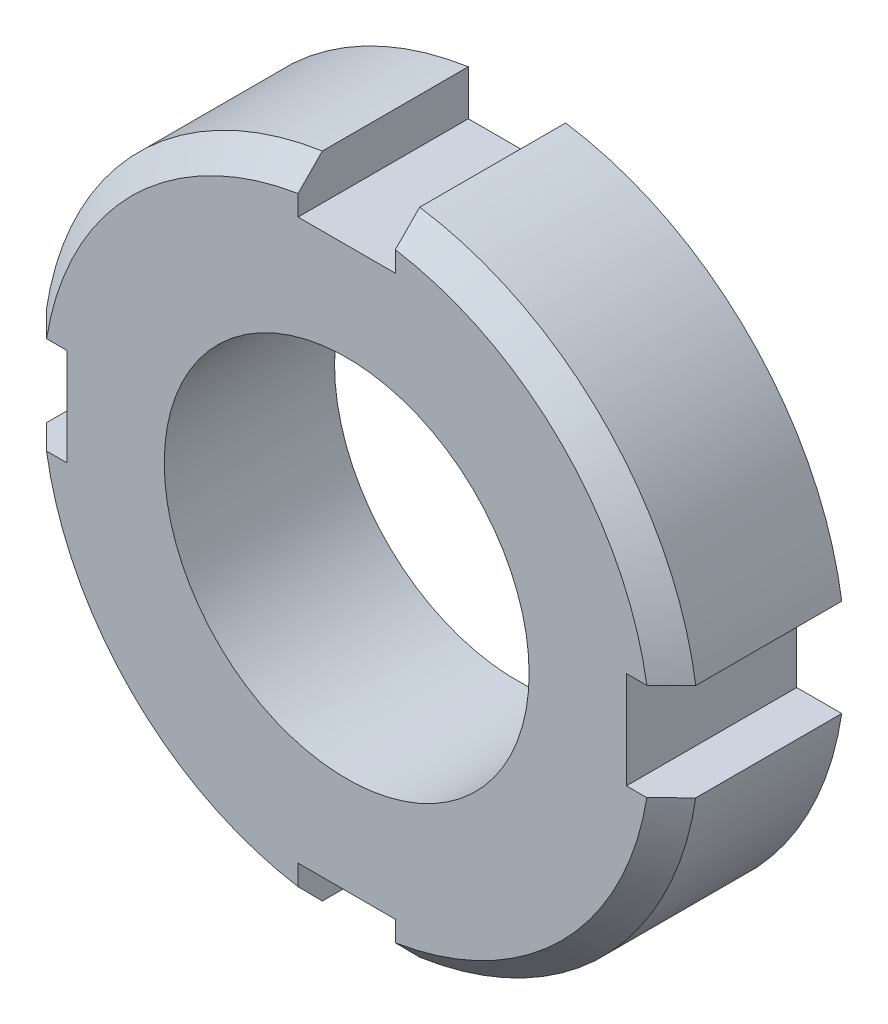
from build123d import *

# Parameters (mm, degrees)
SKETCH2_R           = 13.5
BOSS_EXTRUDE1_DEPTH = 7
SKETCH3_R           = 7.5
CUT_EXTRUDE1_DEPTH  = 21.334699408
SKETCH4_W           = 4
SKETCH4_H           = 4
CUT_EXTRUDE2_DEPTH  = 21.334699408
CHAMFER1_SIZE       = 1


with BuildPart() as part:
    # Sketch2 → Boss-Extrude1 (new body)
    with BuildSketch(Plane.XY):
        Circle(SKETCH2_R)
    extrude(amount=BOSS_EXTRUDE1_DEPTH)

    # Sketch3 → Cut-Extrude1 (cut, through all)
    with BuildSketch(Plane.XY.offset(7)):
        Circle(SKETCH3_R)
    extrude(amount=-CUT_EXTRUDE1_DEPTH, mode=Mode.SUBTRACT)

    # Sketch4 → Cut-Extrude2 (cut, through all)
    with BuildSketch(Plane.XY.offset(7)):
        with Locations((13.5, 0)):
            Rectangle(SKETCH4_W, SKETCH4_H)
        with Locations((0, 13.5)):
            Rectangle(SKETCH4_W, SKETCH4_H)
        with Locations((0, -13.5)):
            Rectangle(SKETCH4_W, SKETCH4_H)
        with Locations((-13.5, 0)):
            Rectangle(SKETCH4_W, SKETCH4_H)
    extrude(amount=-CUT_EXTRUDE2_DEPTH, mode=Mode.SUBTRACT)

    # Chamfer1
    chamfer1_edges = [part.edges().sort_by_distance(p)[0] for p in [
        (-9.545941546, 9.545941546, 7),
        (9.545941546, 9.545941546, 7),
        (9.545941546, -9.545941546, 7),
        (-9.545941546, -9.545941546, 7),
    ]]
    chamfer(chamfer1_edges, length=CHAMFER1_SIZE)


solid = part.part
